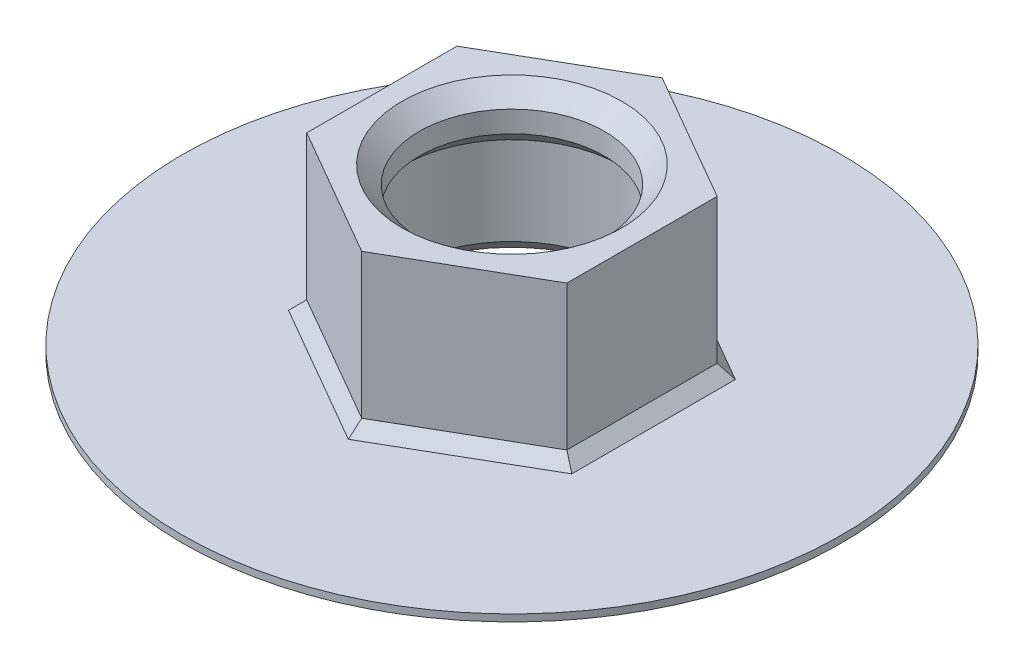
from build123d import *

# Parameters (mm, degrees)
SKETCH1_R                       = 27
SKETCH1_R_2                     = 9.675
BOSS_EXTRUDE1_DEPTH             = 0.6
SKETCH2_R                       = 9.675
BOSS_EXTRUDE2_DEPTH             = 13.5
SKETCH3_R                       = 10.043523413
SKETCH3_R_2                     = 8
BOSS_EXTRUDE3_DEPTH             = 4.85
CHAMFER1_SIZE                   = 1.5
SKETCH4_R                       = 28.5
SKETCH4_R_2                     = 25
BOSS_EXTRUDE4_DEPTH             = 1.9
BOSS_EXTRUDE4_DIRECTION_2_REACH = 42.704
CHAMFER3_SIZE                   = 1
CUT_EXTRUDE1_START              = -1.9
SKETCH5_R                       = 28.5
CUT_EXTRUDE1_DEPTH              = 1.9


with BuildPart() as part:
    # Sketch1 → Boss-Extrude1 (new body)
    with BuildSketch(Plane(origin=(0, 0, 0), x_dir=(1, 0, 0), z_dir=(0, 1, 0))):
        with Locations(Location((0, 0, 0), (0, 0, 270))):
            Circle(SKETCH1_R)
        with Locations(Location((0, 0, 0), (0, 0, 270))):
            Circle(SKETCH1_R_2, mode=Mode.SUBTRACT)
    extrude(amount=BOSS_EXTRUDE1_DEPTH)

    # Sketch2 → Boss-Extrude2 (add)
    with BuildSketch(Plane(origin=(0, 0.6, 0), x_dir=(1, 0, 0), z_dir=(0, 1, 0))):
        Polygon((0, 12.990381057), (-11.25, 6.495190528), (-11.25, -6.495190528), (0, -12.990381057), (11.25, -6.495190528), (11.25, 6.495190528), align=None)
        with Locations(Location((0, 0, 0), (0, 0, 270))):
            Circle(SKETCH2_R, mode=Mode.SUBTRACT)
    extrude(amount=BOSS_EXTRUDE2_DEPTH)

    # Sketch3 → Boss-Extrude3 (add)
    with BuildSketch(Plane(origin=(0, 14.1, 0), x_dir=(1, 0, 0), z_dir=(0, 1, 0))):
        Circle(SKETCH3_R)
        with Locations(Location((0, 0, 0), (0, 0, 270))):
            Circle(SKETCH3_R_2, mode=Mode.SUBTRACT)
    extrude(amount=-BOSS_EXTRUDE3_DEPTH)

    # Chamfer1
    chamfer1_edges = [part.edges().sort_by_distance(p)[0] for p in [
        (0, 9.25, -8),
        (0, 14.1, -8),
        (0, 0, -9.675),
    ]]
    chamfer(chamfer1_edges, length=CHAMFER1_SIZE)

    # Sketch4 → Boss-Extrude4 (add)
    with BuildSketch(Plane.XZ):
        with Locations(Location((0, 0, 0), (0, 0, 270))):
            Circle(SKETCH4_R)
        with Locations(Location((0, 0, 0), (0, 0, 270))):
            Circle(SKETCH4_R_2, mode=Mode.SUBTRACT)
    extrude(amount=BOSS_EXTRUDE4_DEPTH)

    # Boss-Extrude4 direction 2: up to this face of the body (flat: up to its plane)
    boss_extrude4_direction_2_end = Plane(part.part.faces().sort_by_distance((0, 0.6, -26.236324676))[0])
    # Sketch4 → Boss-Extrude4 direction 2 (add, up to the picked face)
    with BuildSketch(Plane.XZ, mode=Mode.PRIVATE) as boss_extrude4_direction_2_sk1:
        with Locations(Location((0, 0, 0), (0, 0, 270))):
            Circle(SKETCH4_R)
        with Locations(Location((0, 0, 0), (0, 0, 270))):
            Circle(SKETCH4_R_2, mode=Mode.SUBTRACT)
    boss_extrude4_direction_2_tool1 = split(extrude(boss_extrude4_direction_2_sk1.sketch, amount=-BOSS_EXTRUDE4_DIRECTION_2_REACH, mode=Mode.PRIVATE), bisect_by=boss_extrude4_direction_2_end, keep=Keep.BOTH, mode=Mode.PRIVATE)
    add(boss_extrude4_direction_2_tool1.solids().sort_by(Axis((0, 0, 27.693898), (0, 1, 0)))[0])

    # Chamfer3
    chamfer3_edges = [part.edges().sort_by_distance(p)[0] for p in [
        (5.625, 0.6, -9.742785793),
        (-5.625, 0.6, -9.742785793),
        (-11.25, 0.6, 0),
        (-5.625, 0.6, 9.742785793),
        (5.625, 0.6, 9.742785793),
        (11.25, 0.6, 0),
    ]]
    chamfer(chamfer3_edges, length=CHAMFER3_SIZE)

    # Sketch5 → Cut-Extrude1 (cut)
    with BuildSketch(Plane.XZ.offset(1.9).offset(CUT_EXTRUDE1_START)):
        with Locations(Location((0, 0, 0), (0, 0, 90))):
            Circle(SKETCH5_R)
    extrude(amount=CUT_EXTRUDE1_DEPTH, mode=Mode.SUBTRACT)


solid = part.part
